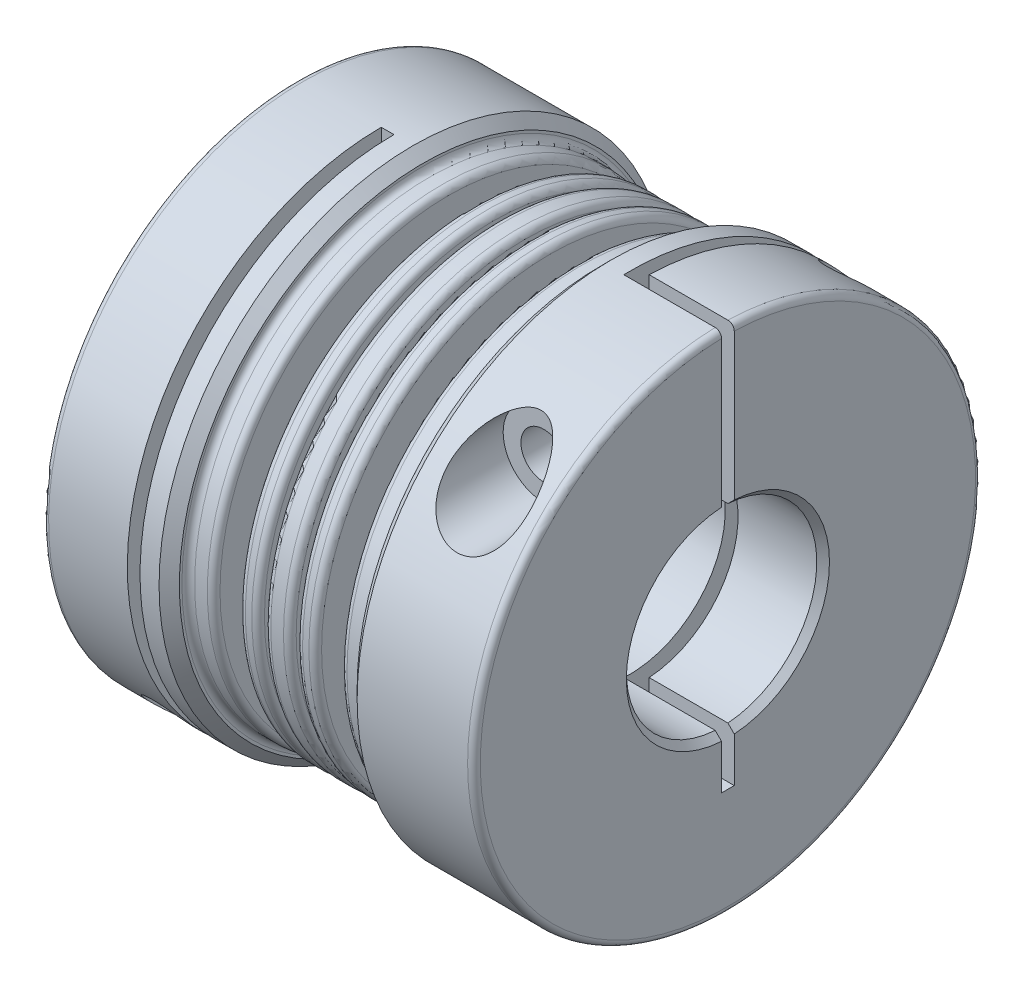
from build123d import *

# Parameters (mm, degrees)
SKETCH2_R                      = 18.5
SKETCH2_R_2                    = 7.5
BOSS_EXTRUDE1_DEPTH            = 1.5
CHAMFER2_SIZE                  = 0.8
FILLET1_R                      = 0.5
LPATTERN1_COUNT                = 2
LPATTERN1_PITCH                = 2
FILLET1_OF_LPATTERN1_R         = 0.5
FILLET2_R                      = 0.5
CUT_EXTRUDE1_REACH             = 35
SKETCH3_W                      = 11.855554905
SKETCH3_H                      = 1
CUT_EXTRUDE1_DIRECTION_2_DEPTH = 11.5
SKETCH5_W                      = 1
SKETCH5_H                      = 20
CUT_REVOLVE1_ANGLE             = 180
FILLET3_R                      = 0.5
CHAMFER3_SIZE                  = 0.5
BODY_MOVE_COPY1_ANGLE          = 180


with BuildPart() as part:
    # Sketch1 → Revolve1 (revolve)
    with BuildSketch(Plane.XY, mode=Mode.PRIVATE) as revolve1_sk:
        Polygon((-17, 20), (-7, 20), (-7, 18.5), (-5, 18.5), (-5, 12), (0, 12), (0, 7.5), (-17, 7.5), align=None)
    revolve(revolve1_sk.sketch.rotate(Axis((0, 0, 0), (-1, 0, 0)), 90), axis=Axis((0, 0, 0), (-1, 0, 0)))

    # Sketch2 → Boss-Extrude1 (add)
    with BuildSketch(Plane(origin=(-3, 0, 0), x_dir=(0, 0, -1), z_dir=(1, 0, 0))):
        Circle(SKETCH2_R)
        Circle(SKETCH2_R_2, mode=Mode.SUBTRACT)
    boss_extrude1 = extrude(amount=BOSS_EXTRUDE1_DEPTH)

    # Chamfer2
    chamfer2_edges = [part.edges().sort_by_distance(p)[0] for p in [
        (-7, 0, 20),
    ]]
    chamfer(chamfer2_edges, length=CHAMFER2_SIZE)

    # Fillet1
    fillet1_edges = [part.edges().sort_by_distance(p)[0] for p in [
        (-1.5, 0, 18.5),
        (-3, 0, 18.5),
    ]]
    fillet(fillet1_edges, radius=FILLET1_R)

    # LPattern1: Boss-Extrude1 ×2
    with Locations(*[(i * LPATTERN1_PITCH, 0, 0) for i in range(1, LPATTERN1_COUNT)]):
        add(boss_extrude1)

    # Fillet1 of LPattern1
    fillet1_of_lpattern1_edges = [part.edges().sort_by_distance(p)[0] for p in [
        (0.5, 0, 18.5),
        (-1, 0, 18.5),
    ]]
    fillet(fillet1_of_lpattern1_edges, radius=FILLET1_OF_LPATTERN1_R)

    # Fillet2
    fillet2_edges = [part.edges().sort_by_distance(p)[0] for p in [
        (-5, 0, 18.5),
        (-7, 0, 18.5),
    ]]
    fillet(fillet2_edges, radius=FILLET2_R)

    # Sketch3 → Cut-Extrude1 (cut, up to next)
    with BuildSketch(Plane(origin=(0, 0, 0), x_dir=(1, 0, 0), z_dir=(0, 1, 0)), mode=Mode.PRIVATE) as cut_extrude1_sk1:
        with Locations((-15.227777453, 0)):
            Rectangle(SKETCH3_W, SKETCH3_H)
    cut_extrude1_tool1 = extrude(cut_extrude1_sk1.sketch, amount=-CUT_EXTRUDE1_REACH, mode=Mode.PRIVATE) & part.part
    add(cut_extrude1_tool1.solids().sort_by_distance((-15.227777, 0, 0))[0], mode=Mode.SUBTRACT)

    # Sketch3 → Cut-Extrude1 direction 2 (cut)
    with BuildSketch(Plane(origin=(0, 0, 0), x_dir=(1, 0, 0), z_dir=(0, 1, 0))):
        with Locations((-15.227777453, 0)):
            Rectangle(SKETCH3_W, SKETCH3_H)
    extrude(amount=CUT_EXTRUDE1_DIRECTION_2_DEPTH, mode=Mode.SUBTRACT)

    # Sketch5 → Cut-Revolve1 (revolve, cut)
    with BuildSketch(Plane.XY):
        with Locations((-9.8, -10)):
            Rectangle(SKETCH5_W, SKETCH5_H)
    revolve(axis=Axis((-9.3, 0, 0), (-1, 0, 0)), revolution_arc=CUT_REVOLVE1_ANGLE, mode=Mode.SUBTRACT)

    # Sketch11 → Cut-Revolve3 (revolve, cut)
    with BuildSketch(Plane(origin=(0, -14, 0), x_dir=(1, 0, 0), z_dir=(0, 1, 0)), mode=Mode.PRIVATE) as cut_revolve3_sk:
        Polygon((-15.7, 20), (-15.7, 10), (-14.3, 10), (-14.3, -22.005521723), (-12.5, -22.005521723), (-12.5, 20), align=None)
    revolve(cut_revolve3_sk.sketch.rotate(Axis((-12.5, -14, 22.005521723), (0, 0, -1)), 180), axis=Axis((-12.5, -14, 22.005521723), (0, 0, -1)), mode=Mode.SUBTRACT)

    # Fillet3
    fillet3_edges = [part.edges().sort_by_distance(p)[0] for p in [
        (-17, 14.317821063, 13.964240044),
    ]]
    fillet(fillet3_edges, radius=FILLET3_R)

    # Chamfer3
    chamfer3_edges = [part.edges().sort_by_distance(p)[0] for p in [
        (-17, 0, 7.5),
        (-17, -5.123475383, -5.477225575),
    ]]
    chamfer(chamfer3_edges, length=CHAMFER3_SIZE)


with BuildPart() as body_2:
    # Mirror1: mirrored copy
    add(part.part.mirror(Plane(origin=(0, 0, 0), x_dir=(0, 0, 1), z_dir=(1, 0, 0))))


with BuildPart() as body_2_1:
    # Body-Move/Copy1: moved
    add(body_2.part.rotate(Axis((0, 0, 0), (1, 0, 0)), BODY_MOVE_COPY1_ANGLE))


with BuildPart() as part_1:
    add(part.part)

    # Combine1: union body 2
    add(body_2_1.part)


solid = part_1.part
